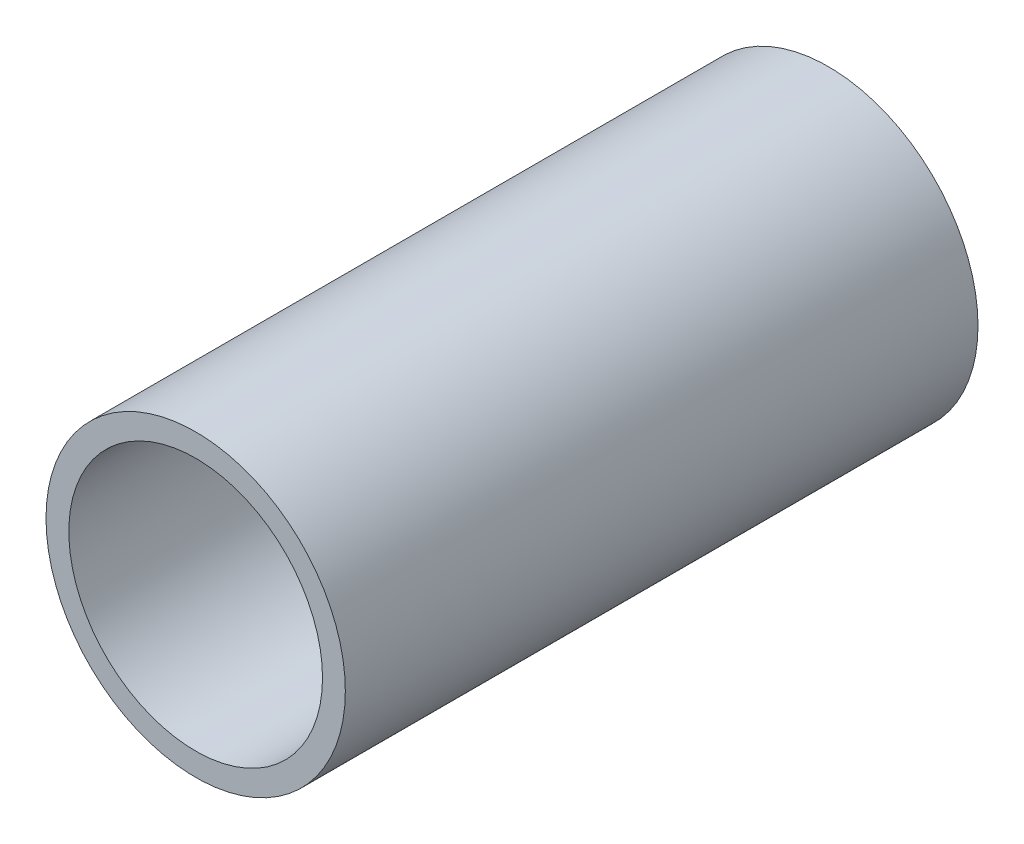
from build123d import *

# Parameters (mm, degrees)
ESBO_O1_R       = 24.13
ESBO_O1_R_2     = 20.45
EXTRUS_O1_DEPTH = 51


with BuildPart() as part:
    # Esboço1 → Extrusão1 (new, symmetric)
    with BuildSketch(Plane.XY):
        Circle(ESBO_O1_R)
        Circle(ESBO_O1_R_2, mode=Mode.SUBTRACT)
    extrude(amount=EXTRUS_O1_DEPTH, both=True)


solid = part.part
